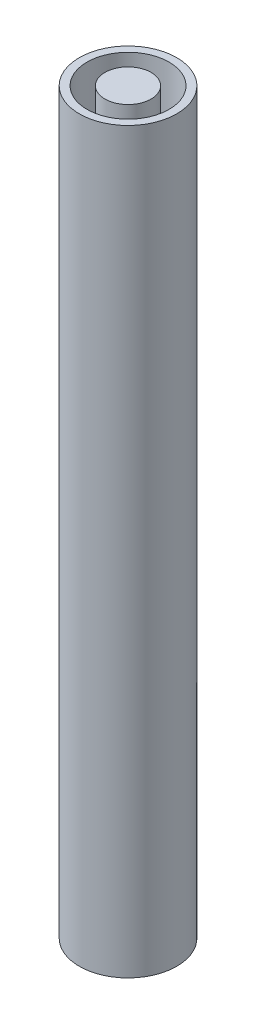
from build123d import *

# Parameters (mm, degrees)
SKETCH1_W   = 28.575
SKETCH1_H   = 914.4
SKETCH1_W_2 = 9.525


with BuildPart() as part:
    # Sketch1 → Revolve1 (revolve)
    with BuildSketch(Plane.XY, mode=Mode.PRIVATE) as revolve1_sk:
        with Locations((14.2875, 457.2)):
            Rectangle(SKETCH1_W, SKETCH1_H)
        with Locations((55.5625, 457.2)):
            Rectangle(SKETCH1_W_2, SKETCH1_H)
    revolve(revolve1_sk.sketch.rotate(Axis((0, 0, 0), (0, -1, 0)), 270), axis=Axis((0, 0, 0), (0, -1, 0)))


solid = part.part
